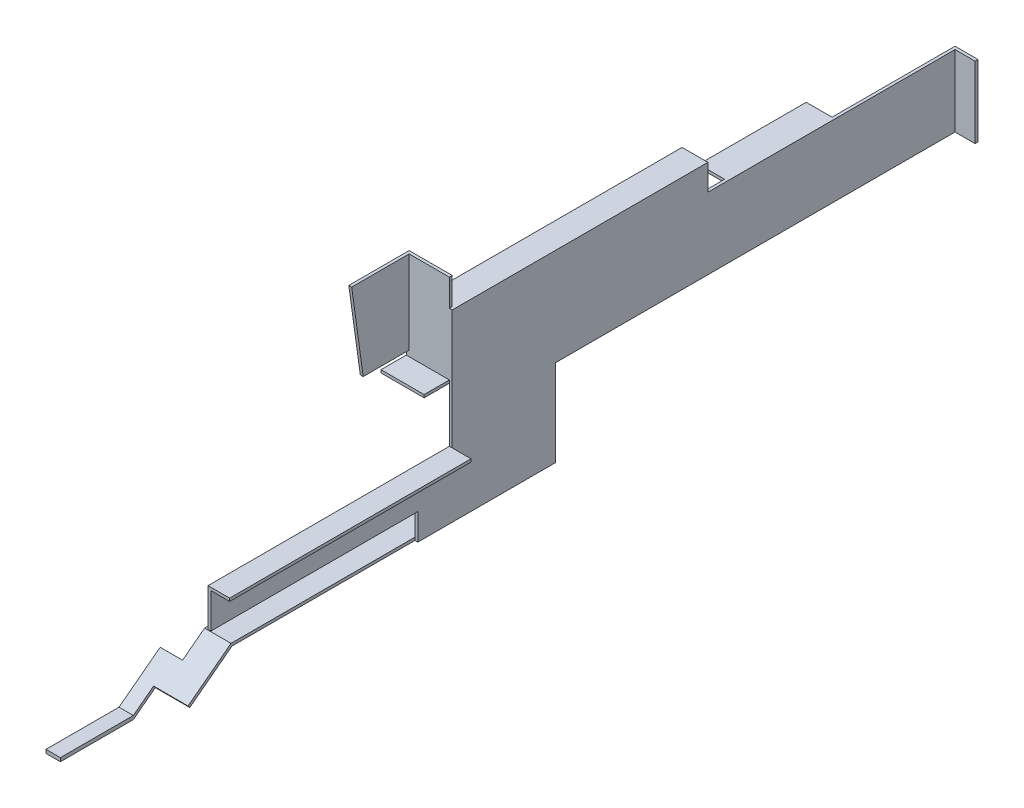
from build123d import *

# Parameters (mm, degrees)
SKETCH_1_W               = 44
SKETCH_1_H               = 6.22
EXTRUDE_1_DEPTH          = 0.25
SKETCH_2_W               = 0.25
SKETCH_2_H               = 6.22
EXTRUDE_2_DEPTH          = 1.75
SKETCH_4_W               = 34
SKETCH_4_H               = 0.25
SKETCH_4_W_2             = 9.35
EXTRUDE_3_DEPTH          = 2.25
SKETCH_5_W               = 22.25
SKETCH_5_H               = 2.25
SKETCH_5_W_2             = 9
SKETCH_5_H_2             = 7.53
EXTRUDE_4_DEPTH          = 0.25
SKETCH_6_W               = 21
SKETCH_6_H               = 5.6
EXTRUDE_5_DEPTH          = 0.25
SKETCH_7_W               = 18
SKETCH_7_H               = 2.3
CUT_EXTRUDE_1_DEPTH      = 45.877509958
SKETCH_8_W               = 21
SKETCH_8_H               = 0.25
EXTRUDE_6_DEPTH          = 1.63
SKETCH_9_W               = 28
SKETCH_9_H               = 0.25
EXTRUDE_7_DEPTH          = 2.3
EXTRUDE_8_DEPTH          = 2.3
EXTRUDE_9_DEPTH          = 1.95
SKETCH_12_W              = 2.3
SKETCH_12_H              = 2.401936356
CUT_EXTRUDE_2_DEPTH      = 51.369645687
CUT_EXTRUDE_3_DEPTH      = 49.492266831
CUT_EXTRUDE_3_DEPTH_BACK = 49.492266831
SKETCH_13_W              = 0.7
SKETCH_13_H              = 8.10994941
CUT_EXTRUDE_4_DEPTH      = 0.7
SKETCH_15_W              = 22.25
SKETCH_15_H              = 0.25
EXTRUDE_10_DEPTH         = 2
EXTRUDE_11_DEPTH         = 0.25
CUT_EXTRUDE_5_REACH      = 48.336
SKETCH_17_W              = 4.75
SKETCH_17_H              = 8
SKETCH_18_W              = 3.75
SKETCH_18_H              = 0.25
EXTRUDE_12_DEPTH         = 2.2
EXTRUDE_13_DEPTH         = 0.25


with BuildPart() as part:
    # 草图1 → 凸台-拉伸1 (new body)
    with BuildSketch(Plane(origin=(0, 0, 0), x_dir=(0, 0, -1), z_dir=(1, 0, 0))):
        with Locations((22, 3.11)):
            Rectangle(SKETCH_1_W, SKETCH_1_H)
    extrude(amount=EXTRUDE_1_DEPTH)

    # 草图2 → 凸台-拉伸2 (add)
    with BuildSketch(Plane(origin=(0.25, 0, 0), x_dir=(0, 0, -1), z_dir=(1, 0, 0))):
        with Locations((43.875, 3.11)):
            Rectangle(SKETCH_2_W, SKETCH_2_H)
    extrude(amount=EXTRUDE_2_DEPTH)

    # 草图4 → 凸台-拉伸3 (add)
    with BuildSketch(Plane.ZY):
        with Locations((-27, 0.125)):
            Rectangle(SKETCH_4_W, SKETCH_4_H)
        with Locations((-28.625, 6.095)):
            Rectangle(SKETCH_4_W_2, SKETCH_4_H)
    extrude(amount=EXTRUDE_3_DEPTH)

    # 草图5 → 凸台-拉伸4 (add)
    with BuildSketch(Plane(origin=(0.25, 0, 0), x_dir=(0, 0, -1), z_dir=(1, 0, 0))):
        with Locations((11.125, 7.345)):
            Rectangle(SKETCH_5_W, SKETCH_5_H)
        with Locations((4.5, -3.765)):
            Rectangle(SKETCH_5_W_2, SKETCH_5_H_2)
    extrude(amount=-EXTRUDE_4_DEPTH)

    # 草图6 → 凸台-拉伸5 (add)
    with BuildSketch(Plane(origin=(0.25, 0, 0), x_dir=(0, 0, -1), z_dir=(1, 0, 0))):
        with Locations((-10.5, -4.73)):
            Rectangle(SKETCH_6_W, SKETCH_6_H)
    extrude(amount=-EXTRUDE_5_DEPTH)

    # 草图7 → 切除-拉伸1 (cut, through all)
    with BuildSketch(Plane(origin=(0.25, 0, 0), x_dir=(0, 0, -1), z_dir=(1, 0, 0))):
        with Locations((-12, -6.38)):
            Rectangle(SKETCH_7_W, SKETCH_7_H)
    extrude(amount=-CUT_EXTRUDE_1_DEPTH, mode=Mode.SUBTRACT)

    # 草图8 → 凸台-拉伸6 (add)
    with BuildSketch(Plane(origin=(0.25, 0, 0), x_dir=(0, 0, -1), z_dir=(1, 0, 0))):
        with Locations((-10.5, -2.055)):
            Rectangle(SKETCH_8_W, SKETCH_8_H)
    extrude(amount=EXTRUDE_6_DEPTH)

    # 草图9 → 凸台-拉伸7 (add)
    with BuildSketch(Plane.ZY):
        with Locations((5, -7.405)):
            Rectangle(SKETCH_9_W, SKETCH_9_H)
    extrude(amount=EXTRUDE_7_DEPTH)

    # 草图10 → 凸台-拉伸8 (add)
    with BuildSketch(Plane.ZY.offset(2.3)):
        Polygon((19, -7.28), (24.5, -11.465833127), (24.5, -11.78), (18.91568756, -7.53), (19, -7.53), align=None)
    extrude(amount=-EXTRUDE_8_DEPTH)

    # 草图11 → 凸台-拉伸9 (add)
    with BuildSketch(Plane.ZY.offset(2.3)):
        Polygon((24.5, -11.465833127), (20.919100499, -8.740551717), (20.767695976, -8.939490578), (24.5, -11.78), (30.85, -11.78), (30.85, -11.465833127), align=None)
    extrude(amount=EXTRUDE_9_DEPTH)

    # 草图12 → 切除-拉伸2 (cut, through all)
    with BuildSketch(Plane(origin=(0, 4.546663396, 3.460286229), x_dir=(1, 0, 0), z_dir=(0, 0.795755444677028, 0.6056180910993872))):
        with Locations((-1.15, -25.42922133)):
            Rectangle(SKETCH_12_W, SKETCH_12_H)
    extrude(amount=-CUT_EXTRUDE_2_DEPTH, mode=Mode.SUBTRACT)

    # 草图13 → 切除-拉伸3 (cut, two sides: drawn at the far end of the back side and taken through both)
    with BuildSketch(Plane(origin=(0, -11.465833127, 0), x_dir=(1, 0, 0), z_dir=(0, 1, 0)).offset(-CUT_EXTRUDE_3_DEPTH_BACK)):
        with Locations((-2.65, -26.795025295)):
            Rectangle(SKETCH_13_W, SKETCH_13_H)
    extrude(amount=CUT_EXTRUDE_3_DEPTH + CUT_EXTRUDE_3_DEPTH_BACK, mode=Mode.SUBTRACT)

    # 草图14 → 切除-拉伸4 (cut)
    with BuildSketch(Plane(origin=(-2.3, 0, 0), x_dir=(0, 0, -1), z_dir=(1, 0, 0))):
        Polygon((-22.74005059, -10.126405028), (-22.74005059, -10.440571902), (-22.588646067, -10.325343889), align=None)
    extrude(amount=-CUT_EXTRUDE_4_DEPTH, mode=Mode.SUBTRACT)

    # 草图15 → 凸台-拉伸10 (add)
    with BuildSketch(Plane.ZY):
        with Locations((-11.125, 8.345)):
            Rectangle(SKETCH_15_W, SKETCH_15_H)
    extrude(amount=EXTRUDE_10_DEPTH)

    # 草图16 → 凸台-拉伸11 (add)
    with BuildSketch(Plane.XY):
        Polygon((0, 2.82), (0, 8.22), (-2, 8.22), (-2, 8.47), (0, 8.47), (0, 10.82), (-8.5, 10.82), (-5, 2.82), align=None)
    extrude(amount=-EXTRUDE_11_DEPTH)

    # 草图17 → 切除-拉伸5 (cut, up to next)
    with BuildSketch(Plane.XY, mode=Mode.PRIVATE) as cut_extrude_5_sk1:
        with Locations((-6.125, 6.82)):
            Rectangle(SKETCH_17_W, SKETCH_17_H)
    cut_extrude_5_tool1 = extrude(cut_extrude_5_sk1.sketch, amount=-CUT_EXTRUDE_5_REACH, mode=Mode.PRIVATE) & part.part
    add(cut_extrude_5_tool1.solids().sort_by_distance((-6.125, 6.82, 0))[0], mode=Mode.SUBTRACT)

    # 草图18 → 凸台-拉伸12 (add)
    with BuildSketch(Plane.XY):
        with Locations((-1.875, 2.945)):
            Rectangle(SKETCH_18_W, SKETCH_18_H)
    extrude(amount=EXTRUDE_12_DEPTH)

    # 草图19 → 凸台-拉伸13 (add)
    with BuildSketch(Plane.ZY.offset(3.75)):
        Polygon((0, 10.82), (5, 10.82), (4, 3.57), (0, 3.57), align=None)
    extrude(amount=-EXTRUDE_13_DEPTH)


solid = part.part
